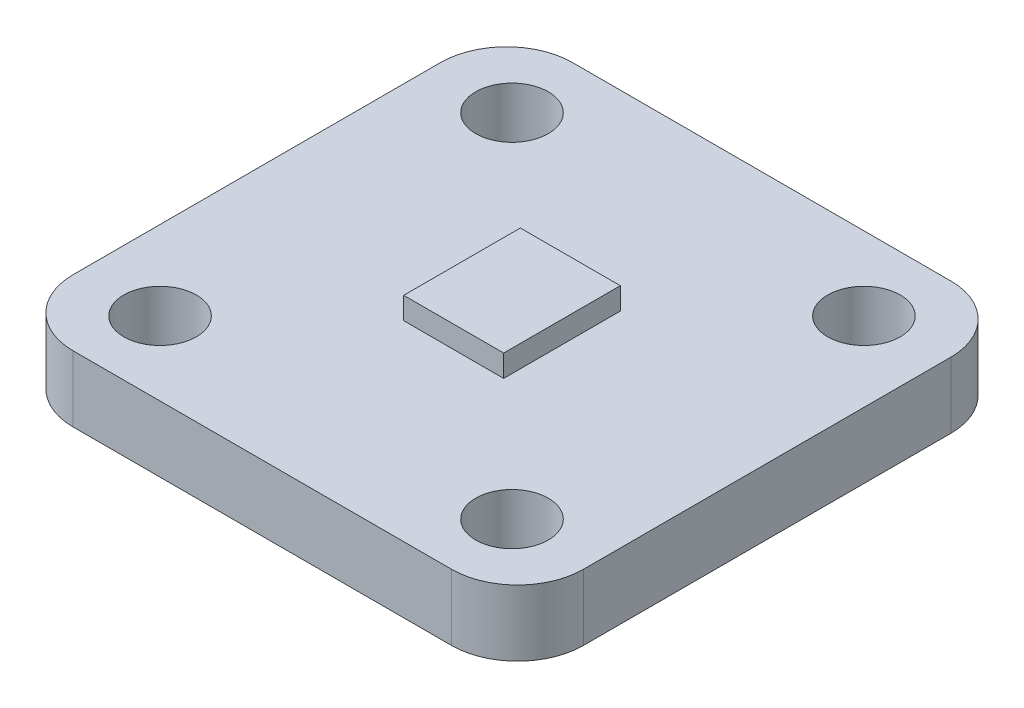
from build123d import *

# Parameters (mm, degrees)
SKETCH_1_W      = 23.2
SKETCH_1_H      = 22.7
SKETCH_1_R      = 1.65
EXTRUDE_1_DEPTH = 3
FILLET_1_R      = 3
SKETCH_2_W      = 4.543947028
SKETCH_2_H      = 5.301271532
EXTRUDE_2_DEPTH = 1


with BuildPart() as part:
    # 草图1 → 凸台-拉伸1 (new body)
    with BuildSketch(Plane(origin=(0, 0, 0), x_dir=(1, 0, 0), z_dir=(0, 1, 0))):
        Rectangle(SKETCH_1_W, SKETCH_1_H)
        with Locations(Location((-8, 8, 0), (0, 0, 270))):
            Circle(SKETCH_1_R, mode=Mode.SUBTRACT)
        with Locations(Location((8, 8, 0), (0, 0, 270))):
            Circle(SKETCH_1_R, mode=Mode.SUBTRACT)
        with Locations(Location((8, -8, 0), (0, 0, 270))):
            Circle(SKETCH_1_R, mode=Mode.SUBTRACT)
        with Locations(Location((-8, -8, 0), (0, 0, 270))):
            Circle(SKETCH_1_R, mode=Mode.SUBTRACT)
    extrude(amount=EXTRUDE_1_DEPTH)

    # 圆角1
    fillet_1_edges = [part.edges().sort_by_distance(p)[0] for p in [
        (11.6, 1.5, 11.35),
        (-11.6, 1.5, 11.35),
        (-11.6, 1.5, -11.35),
        (11.6, 1.5, -11.35),
    ]]
    fillet(fillet_1_edges, radius=FILLET_1_R)

    # 草图2 → 凸台-拉伸2 (add)
    with BuildSketch(Plane(origin=(0, 3, 0), x_dir=(1, 0, 0), z_dir=(0, 1, 0))):
        Rectangle(SKETCH_2_W, SKETCH_2_H)
    extrude(amount=EXTRUDE_2_DEPTH)


solid = part.part
